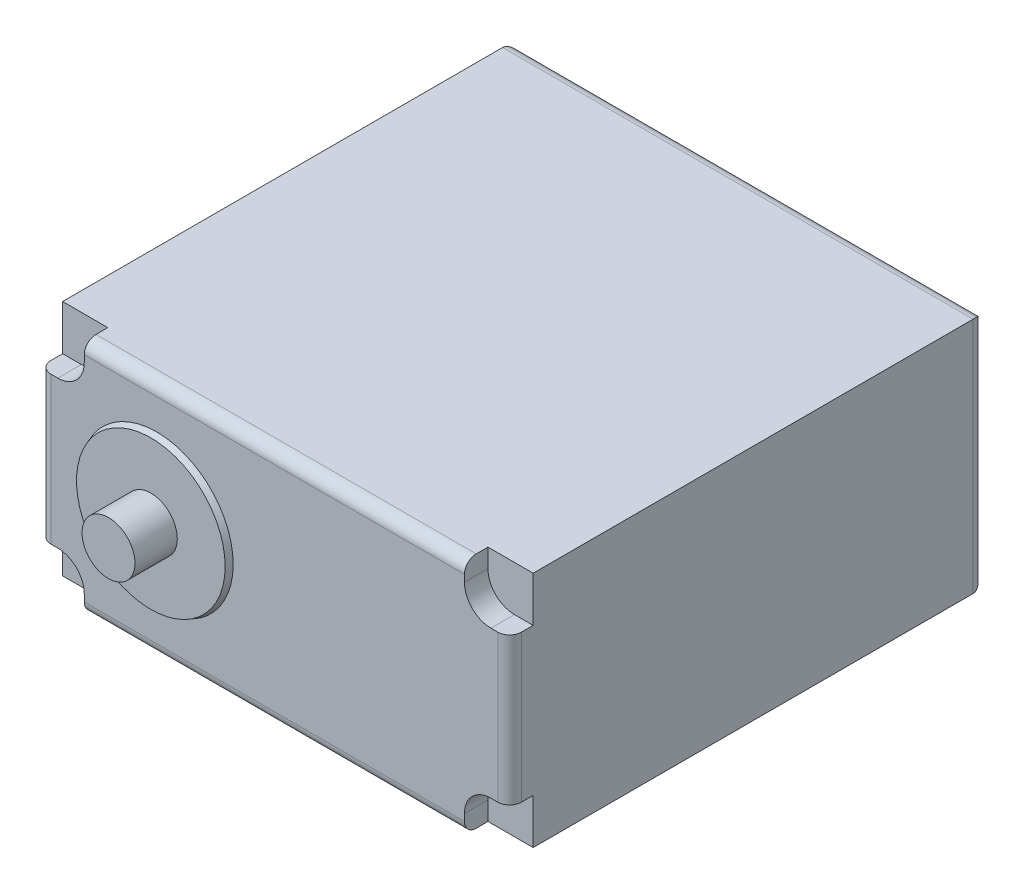
from build123d import *

# Parameters (mm, degrees)
SKETCH1_W           = 40
SKETCH1_H           = 40.4
BOSS_EXTRUDE1_DEPTH = 20.2
FILLET1_R           = 1
FILLET2_R           = 1
CUT_EXTRUDE1_DEPTH  = 2
SKETCH3_R           = 6.5
BOSS_EXTRUDE2_DEPTH = 0.5
BOSS_EXTRUDE2_TAPER = 20
SKETCH4_R           = 2.25
BOSS_EXTRUDE3_DEPTH = 3.6


with BuildPart() as part:
    # Sketch1 → Boss-Extrude1 (new body)
    with BuildSketch(Plane(origin=(0, 0, 0), x_dir=(1, 0, 0), z_dir=(0, 1, 0))):
        with Locations((20, 20.2)):
            Rectangle(SKETCH1_W, SKETCH1_H)
    extrude(amount=BOSS_EXTRUDE1_DEPTH)

    # Fillet1
    fillet1_edges = [part.edges().sort_by_distance(p)[0] for p in [
        (20, 0, 0),
        (40, 10.1, 0),
        (0, 10.1, 0),
        (20, 20.2, 0),
    ]]
    fillet(fillet1_edges, radius=FILLET1_R)

    # Fillet2
    fillet2_edges = [part.edges().sort_by_distance(p)[0] for p in [
        (20, 20.2, -40.4),
        (20, 0, -40.4),
        (0, 10.1, -40.4),
        (40, 10.1, -40.4),
    ]]
    fillet(fillet2_edges, radius=FILLET2_R)

    # Sketch2 → Cut-Extrude1 (cut)
    with BuildSketch(Plane.XY):
        with BuildLine():
            Line((1.590990258, 3.840990258), (-0.659009742, 3.840990258))
            Line((-0.659009742, 3.840990258), (-0.659009742, 1.590990258))
            ThreePointArc((-0.659009742, 1.590990258), (0, 0), (1.590990258, -0.659009742))
            Line((1.590990258, -0.659009742), (3.840990258, -0.557681221))
            Line((3.840990258, -0.557681221), (3.840990258, 1.590990258))
            ThreePointArc((3.840990258, 1.590990258), (3.181980515, 3.181980515), (1.590990258, 3.840990258))
        make_face()
        with BuildLine():
            Line((3.840990258, 18.609009742), (3.840990258, 20.859009742))
            Line((3.840990258, 20.859009742), (1.590990258, 20.859009742))
            ThreePointArc((1.590990258, 20.859009742), (0, 20.2), (-0.659009742, 18.609009742))
            Line((-0.659009742, 18.609009742), (-0.659009742, 16.359009742))
            Line((-0.659009742, 16.359009742), (1.590990258, 16.359009742))
            ThreePointArc((1.590990258, 16.359009742), (3.181980515, 17.018019485), (3.840990258, 18.609009742))
        make_face()
        with BuildLine():
            Line((36.159009742, -0.557681221), (38.409009742, -0.659009742))
            ThreePointArc((38.409009742, -0.659009742), (40, 0), (40.659009742, 1.590990258))
            Line((40.659009742, 1.590990258), (40.659009742, 3.840990258))
            Line((40.659009742, 3.840990258), (38.409009742, 3.840990258))
            ThreePointArc((38.409009742, 3.840990258), (36.818019485, 3.181980515), (36.159009742, 1.590990258))
            Line((36.159009742, 1.590990258), (36.159009742, -0.557681221))
        make_face()
        with BuildLine():
            Line((36.159009742, 18.609009742), (36.159009742, 20.859009742))
            Line((36.159009742, 20.859009742), (38.409009742, 20.859009742))
            ThreePointArc((38.409009742, 20.859009742), (40, 20.2), (40.659009742, 18.609009742))
            Line((40.659009742, 18.609009742), (40.659009742, 16.359009742))
            Line((40.659009742, 16.359009742), (38.409009742, 16.359009742))
            ThreePointArc((38.409009742, 16.359009742), (36.818019485, 17.018019485), (36.159009742, 18.609009742))
        make_face()
    extrude(amount=-CUT_EXTRUDE1_DEPTH, mode=Mode.SUBTRACT)

    # Sketch3 → Boss-Extrude2 (add)
    with BuildSketch(Plane.XY):
        with Locations((10, 10.1)):
            Circle(SKETCH3_R)
    boss_extrude2 = extrude(amount=BOSS_EXTRUDE2_DEPTH, taper=BOSS_EXTRUDE2_TAPER)

    # Sketch4 → Boss-Extrude3 (add)
    with BuildSketch(Plane.XY.offset(0.5)):
        with Locations((10, 10.1)):
            Circle(SKETCH4_R)
    boss_extrude3 = extrude(amount=BOSS_EXTRUDE3_DEPTH)

    # Mirror2: Boss-Extrude2, Boss-Extrude3 across plane
    add(boss_extrude2.mirror(Plane(origin=(0, 0, -20.2), x_dir=(1, 0, 0), z_dir=(0, 0, -1))))
    add(boss_extrude3.mirror(Plane(origin=(0, 0, -20.2), x_dir=(1, 0, 0), z_dir=(0, 0, -1))))


solid = part.part
